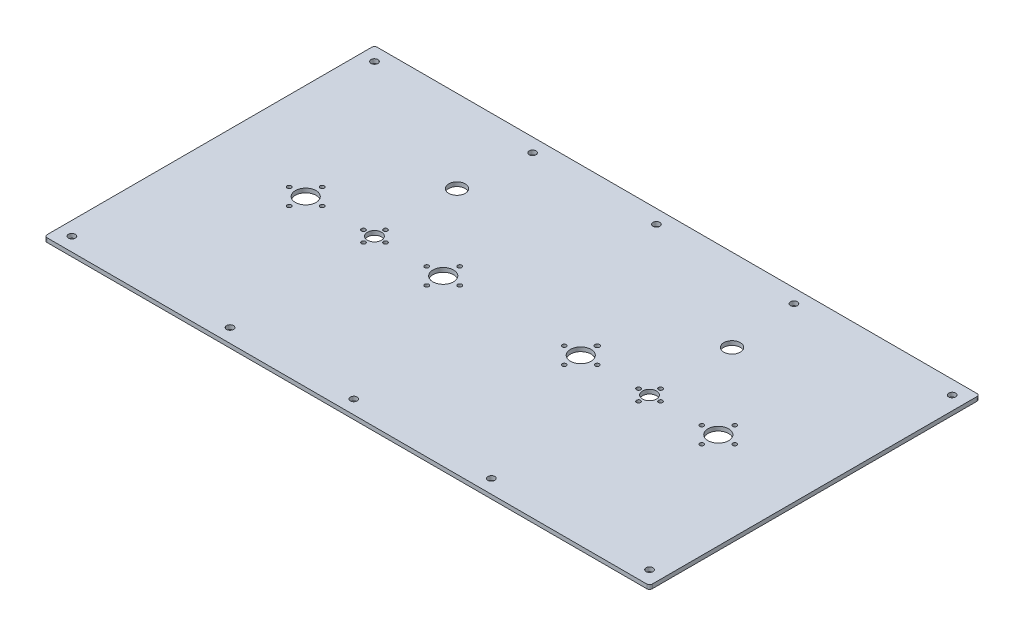
from build123d import *

# Parameters (mm, degrees)
SKETCH_1_R      = 5.1
SKETCH_1_R_2    = 1.5
SKETCH_1_R_3    = 7.5
SKETCH_1_R_4    = 6
SKETCH_1_R_5    = 1.7
SKETCH_1_R_6    = 2.5
EXTRUDE_1_DEPTH = 3


with BuildPart() as part:
    # 草图1 → 凸台-拉伸1 (new body)
    with BuildSketch(Plane(origin=(0, 0, 0), x_dir=(1, 0, 0), z_dir=(0, 1, 0))):
        with BuildLine():
            Line((-18, 220), (418, 220))
            ThreePointArc((418, 220), (419.414213562, 219.414213562), (420, 218))
            Line((420, 218), (420, -18))
            ThreePointArc((420, -18), (419.414213562, -19.414213562), (418, -20))
            Line((418, -20), (-18, -20))
            ThreePointArc((-18, -20), (-19.414213562, -19.414213562), (-20, -18))
            Line((-20, -18), (-20, 218))
            ThreePointArc((-20, 218), (-19.414213562, 219.414213562), (-18, 220))
        make_face()
        with Locations(Location((100, 100, 0), (0, 0, 270))):
            Circle(SKETCH_1_R, mode=Mode.SUBTRACT)
        with Locations(Location((150, 112, 0), (0, 0, 270))):
            Circle(SKETCH_1_R_2, mode=Mode.SUBTRACT)
        with Locations(Location((100, 92, 0), (0, 0, 270))):
            Circle(SKETCH_1_R_2, mode=Mode.SUBTRACT)
        with Locations(Location((108, 100, 0), (0, 0, 270))):
            Circle(SKETCH_1_R_2, mode=Mode.SUBTRACT)
        with Locations(Location((92, 100, 0), (0, 0, 270))):
            Circle(SKETCH_1_R_2, mode=Mode.SUBTRACT)
        with Locations(Location((100, 108, 0), (0, 0, 270))):
            Circle(SKETCH_1_R_2, mode=Mode.SUBTRACT)
        with Locations(Location((50, 100, 0), (0, 0, 270))):
            Circle(SKETCH_1_R_3, mode=Mode.SUBTRACT)
        with Locations(Location((50, 112, 0), (0, 0, 270))):
            Circle(SKETCH_1_R_2, mode=Mode.SUBTRACT)
        with Locations(Location((62, 100, 0), (0, 0, 270))):
            Circle(SKETCH_1_R_2, mode=Mode.SUBTRACT)
        with Locations(Location((50, 88, 0), (0, 0, 270))):
            Circle(SKETCH_1_R_2, mode=Mode.SUBTRACT)
        with Locations(Location((38, 100, 0), (0, 0, 270))):
            Circle(SKETCH_1_R_2, mode=Mode.SUBTRACT)
        with Locations(Location((162, 100, 0), (0, 0, 270))):
            Circle(SKETCH_1_R_2, mode=Mode.SUBTRACT)
        with Locations(Location((138, 100, 0), (0, 0, 270))):
            Circle(SKETCH_1_R_2, mode=Mode.SUBTRACT)
        with Locations(Location((150, 88, 0), (0, 0, 270))):
            Circle(SKETCH_1_R_2, mode=Mode.SUBTRACT)
        with Locations(Location((150, 100, 0), (0, 0, 270))):
            Circle(SKETCH_1_R_3, mode=Mode.SUBTRACT)
        with Locations(Location((100, 160, 0), (0, 0, 270))):
            Circle(SKETCH_1_R_4, mode=Mode.SUBTRACT)
        with Locations(Location((300, 100, 0), (0, 0, 270))):
            Circle(SKETCH_1_R, mode=Mode.SUBTRACT)
        with Locations(Location((350, 112, 0), (0, 0, 270))):
            Circle(SKETCH_1_R_2, mode=Mode.SUBTRACT)
        with Locations(Location((300, 108, 0), (0, 0, 270))):
            Circle(SKETCH_1_R_2, mode=Mode.SUBTRACT)
        with Locations(Location((308, 100, 0), (0, 0, 270))):
            Circle(SKETCH_1_R_2, mode=Mode.SUBTRACT)
        with Locations(Location((300, 92, 0), (0, 0, 270))):
            Circle(SKETCH_1_R_2, mode=Mode.SUBTRACT)
        with Locations(Location((292, 100, 0), (0, 0, 270))):
            Circle(SKETCH_1_R_2, mode=Mode.SUBTRACT)
        with Locations(Location((250, 100, 0), (0, 0, 270))):
            Circle(SKETCH_1_R_3, mode=Mode.SUBTRACT)
        with Locations(Location((250, 112, 0), (0, 0, 270))):
            Circle(SKETCH_1_R_5, mode=Mode.SUBTRACT)
        with Locations(Location((262, 100, 0), (0, 0, 270))):
            Circle(SKETCH_1_R_2, mode=Mode.SUBTRACT)
        with Locations(Location((250, 88, 0), (0, 0, 270))):
            Circle(SKETCH_1_R_2, mode=Mode.SUBTRACT)
        with Locations(Location((238, 100, 0), (0, 0, 270))):
            Circle(SKETCH_1_R_2, mode=Mode.SUBTRACT)
        with Locations(Location((362, 100, 0), (0, 0, 270))):
            Circle(SKETCH_1_R_2, mode=Mode.SUBTRACT)
        with Locations(Location((338, 100, 0), (0, 0, 270))):
            Circle(SKETCH_1_R_2, mode=Mode.SUBTRACT)
        with Locations(Location((350, 88, 0), (0, 0, 270))):
            Circle(SKETCH_1_R_2, mode=Mode.SUBTRACT)
        with Locations(Location((350, 100, 0), (0, 0, 270))):
            Circle(SKETCH_1_R_3, mode=Mode.SUBTRACT)
        with Locations(Location((300, 160, 0), (0, 0, 270))):
            Circle(SKETCH_1_R_4, mode=Mode.SUBTRACT)
        with Locations(Location((410, -10, 0), (0, 0, 270))):
            Circle(SKETCH_1_R_6, mode=Mode.SUBTRACT)
        with Locations(Location((105, -10, 0), (0, 0, 270))):
            Circle(SKETCH_1_R_6, mode=Mode.SUBTRACT)
        with Locations(Location((295, -10, 0), (0, 0, 270))):
            Circle(SKETCH_1_R_6, mode=Mode.SUBTRACT)
        with Locations(Location((-10, -10, 0), (0, 0, 270))):
            Circle(SKETCH_1_R_6, mode=Mode.SUBTRACT)
        with Locations(Location((195, -10, 0), (0, 0, 270))):
            Circle(SKETCH_1_R_6, mode=Mode.SUBTRACT)
        with Locations(Location((195, 210, 0), (0, 0, 270))):
            Circle(SKETCH_1_R_6, mode=Mode.SUBTRACT)
        with Locations(Location((-10, 210, 0), (0, 0, 270))):
            Circle(SKETCH_1_R_6, mode=Mode.SUBTRACT)
        with Locations(Location((295, 210, 0), (0, 0, 270))):
            Circle(SKETCH_1_R_6, mode=Mode.SUBTRACT)
        with Locations(Location((105, 210, 0), (0, 0, 270))):
            Circle(SKETCH_1_R_6, mode=Mode.SUBTRACT)
        with Locations(Location((410, 210, 0), (0, 0, 270))):
            Circle(SKETCH_1_R_6, mode=Mode.SUBTRACT)
    extrude(amount=EXTRUDE_1_DEPTH)


solid = part.part
